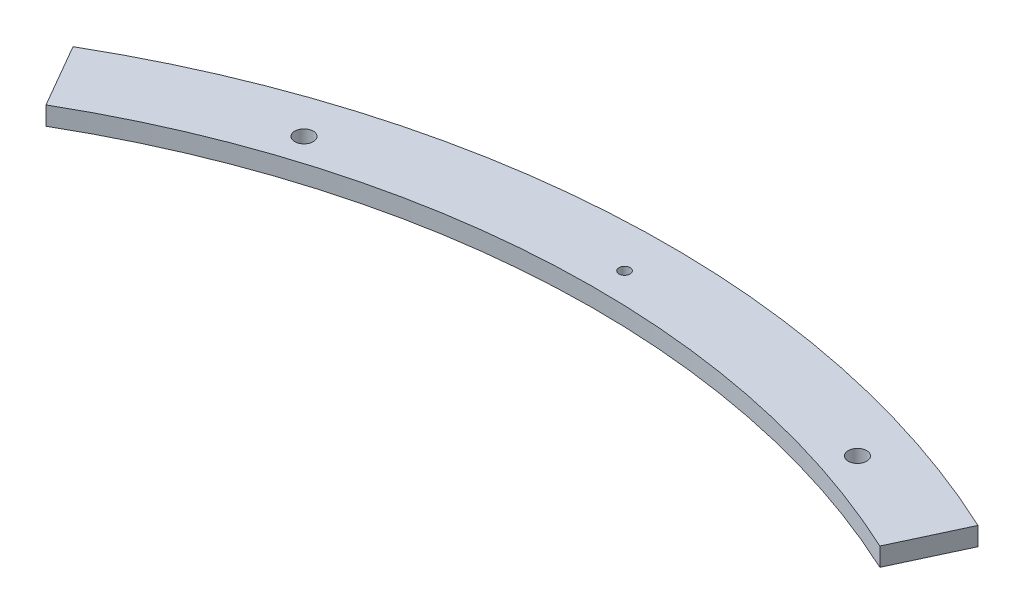
from build123d import *

# Parameters (mm, degrees)
SKETCH1_R           = 254.5
SKETCH1_R_2         = 234.5
BOSS_EXTRUDE1_DEPTH = 5
SKETCH2_W           = 27.805822748
SKETCH2_H           = 60
CUT_EXTRUDE1_DEPTH  = 5
SKETCH3_R           = 2.5
CUT_EXTRUDE2_DEPTH  = 5
SKETCH4_R           = 1.5
CUT_EXTRUDE3_DEPTH  = 5
SKETCH5_W           = 651.212620435
SKETCH5_H           = 357.226439325
CUT_EXTRUDE4_DEPTH  = 10
CUT_EXTRUDE9_START  = -10
SKETCH6_R           = 1.5
SKETCH6_R_2         = 2.5
CUT_EXTRUDE9_DEPTH  = 10
CUT_EXTRUDE10_START = -10
CUT_EXTRUDE10_DEPTH = 10


with BuildPart() as part:
    # Sketch1 → Boss-Extrude1 (new body)
    with BuildSketch(Plane(origin=(0, 0, 0), x_dir=(1, 0, 0), z_dir=(0, 1, 0))):
        with Locations(Location((0, 0, 0), (0, 0, 270))):
            Circle(SKETCH1_R)
        with Locations(Location((0, 0, 0), (0, 0, 270))):
            Circle(SKETCH1_R_2, mode=Mode.SUBTRACT)
    extrude(amount=BOSS_EXTRUDE1_DEPTH)

    # Sketch2 → Cut-Extrude1 (cut)
    with BuildSketch(Plane(origin=(0, 5, 0), x_dir=(1, 0, 0), z_dir=(0, 1, 0))):
        with Locations((-240.597088626, 30)):
            Rectangle(SKETCH2_W, SKETCH2_H)
    cut_extrude1 = extrude(amount=-CUT_EXTRUDE1_DEPTH, mode=Mode.SUBTRACT)

    # Mirror1: Cut-Extrude1 across plane
    add(cut_extrude1.mirror(Plane.XY), mode=Mode.SUBTRACT)

    # Sketch3 → Cut-Extrude2 (cut)
    with BuildSketch(Plane(origin=(0, 5, 0), x_dir=(1, 0, 0), z_dir=(0, 1, 0))):
        with Locations(Location((242.5, 0, 0), (0, 0, 270))):
            Circle(SKETCH3_R)
        with Locations(Location((196.186621136, -142.537923681, 0), (0, 0, 270))):
            Circle(SKETCH3_R)
        with Locations(Location((74.936621136, -230.631205202, 0), (0, 0, 270))):
            Circle(SKETCH3_R)
        with Locations(Location((-74.936621136, -230.631205202, 0), (0, 0, 270))):
            Circle(SKETCH3_R)
        with Locations(Location((-196.186621136, -142.537923681, 0), (0, 0, 270))):
            Circle(SKETCH3_R)
        with Locations((-242.5, 0)):
            Circle(SKETCH3_R)
        with Locations(Location((-196.186621136, 142.537923681, 0), (0, 0, 270))):
            Circle(SKETCH3_R)
        with Locations(Location((-74.936621136, 230.631205202, 0), (0, 0, 270))):
            Circle(SKETCH3_R)
        with Locations(Location((74.936621136, 230.631205202, 0), (0, 0, 270))):
            Circle(SKETCH3_R)
        with Locations(Location((196.186621136, 142.537923681, 0), (0, 0, 270))):
            Circle(SKETCH3_R)
    extrude(amount=-CUT_EXTRUDE2_DEPTH, mode=Mode.SUBTRACT)

    # Sketch4 → Cut-Extrude3 (cut)
    with BuildSketch(Plane(origin=(0, 5, 0), x_dir=(1, 0, 0), z_dir=(0, 1, 0))):
        with Locations(Location((0, -242.5, 0), (0, 0, 270))):
            Circle(SKETCH4_R)
        with Locations(Location((-142.537923681, -196.186621136, 0), (0, 0, 270))):
            Circle(SKETCH4_R)
        with Locations(Location((-230.631205202, -74.936621136, 0), (0, 0, 270))):
            Circle(SKETCH4_R)
        with Locations(Location((-230.631205202, 74.936621136, 0), (0, 0, 270))):
            Circle(SKETCH4_R)
        with Locations(Location((-142.537923681, 196.186621136, 0), (0, 0, 270))):
            Circle(SKETCH4_R)
        with Locations(Location((0, 242.5, 0), (0, 0, 270))):
            Circle(SKETCH4_R)
        with Locations(Location((142.537923681, 196.186621136, 0), (0, 0, 270))):
            Circle(SKETCH4_R)
        with Locations(Location((230.631205202, 74.936621136, 0), (0, 0, 270))):
            Circle(SKETCH4_R)
        with Locations(Location((230.631205202, -74.936621136, 0), (0, 0, 270))):
            Circle(SKETCH4_R)
        with Locations(Location((142.537923681, -196.186621136, 0), (0, 0, 270))):
            Circle(SKETCH4_R)
    extrude(amount=-CUT_EXTRUDE3_DEPTH, mode=Mode.SUBTRACT)

    # Sketch5 → Cut-Extrude4 (cut)
    with BuildSketch(Plane(origin=(0, 5, 0), x_dir=(1, 0, 0), z_dir=(0, 1, 0))):
        with Locations((-71.106310217, -178.613219663)):
            Rectangle(SKETCH5_W, SKETCH5_H)
    extrude(amount=-CUT_EXTRUDE4_DEPTH, mode=Mode.SUBTRACT)

    # Sketch6 → Cut-Extrude9 (cut)
    # profile 1 of 2: a face of its own
    with BuildSketch(Plane(origin=(0, 5, 0), x_dir=(1, 0, 0), z_dir=(0, 1, 0)).offset(CUT_EXTRUDE9_START)):
        with BuildLine():
            Line((-117.25, 203.082957187), (-127.25, 220.403465263))
            ThreePointArc((-127.25, 220.403465263), (-203.737945948, 152.51589878), (-247.326201604, 60))
            Line((-247.326201604, 60), (-226.694177252, 60))
            ThreePointArc((-226.694177252, 60), (-186.259449225, 142.469883043), (-117.25, 203.082957187))
        make_face()
        with Locations((-230.631205202, 74.936621136)):
            Circle(SKETCH6_R, mode=Mode.SUBTRACT)
        with Locations((-196.186621136, 142.537923681)):
            Circle(SKETCH6_R_2, mode=Mode.SUBTRACT)
        with Locations((-142.537923681, 196.186621136)):
            Circle(SKETCH6_R, mode=Mode.SUBTRACT)
    # profile 2 of 2: a face of its own
    with BuildSketch(Plane(origin=(0, 5, 0), x_dir=(1, 0, 0), z_dir=(0, 1, 0)).offset(CUT_EXTRUDE9_START)):
        with BuildLine():
            Line((-254.5, 0), (0, 0))
            Line((0, 0), (-117.25, 203.082957187))
            ThreePointArc((-117.25, 203.082957187), (-186.259449225, 142.469883043), (-226.694177252, 60))
            Line((-226.694177252, 60), (-247.326201604, 60))
            ThreePointArc((-247.326201604, 60), (-252.700186296, 30.213669851), (-254.5, 0))
        make_face()
    extrude(amount=CUT_EXTRUDE9_DEPTH, mode=Mode.SUBTRACT)

    # Sketch7 → Cut-Extrude10 (cut)
    with BuildSketch(Plane(origin=(0, 5, 0), x_dir=(1, 0, 0), z_dir=(0, 1, 0)).offset(CUT_EXTRUDE10_START)):
        with BuildLine():
            Line((254.5, 0), (0, 0))
            Line((0, 0), (107.556347613, 230.655331801))
            ThreePointArc((107.556347613, 230.655331801), (214.643122959, 136.742750324), (254.5, 0))
        make_face()
    extrude(amount=CUT_EXTRUDE10_DEPTH, mode=Mode.SUBTRACT)


solid = part.part
